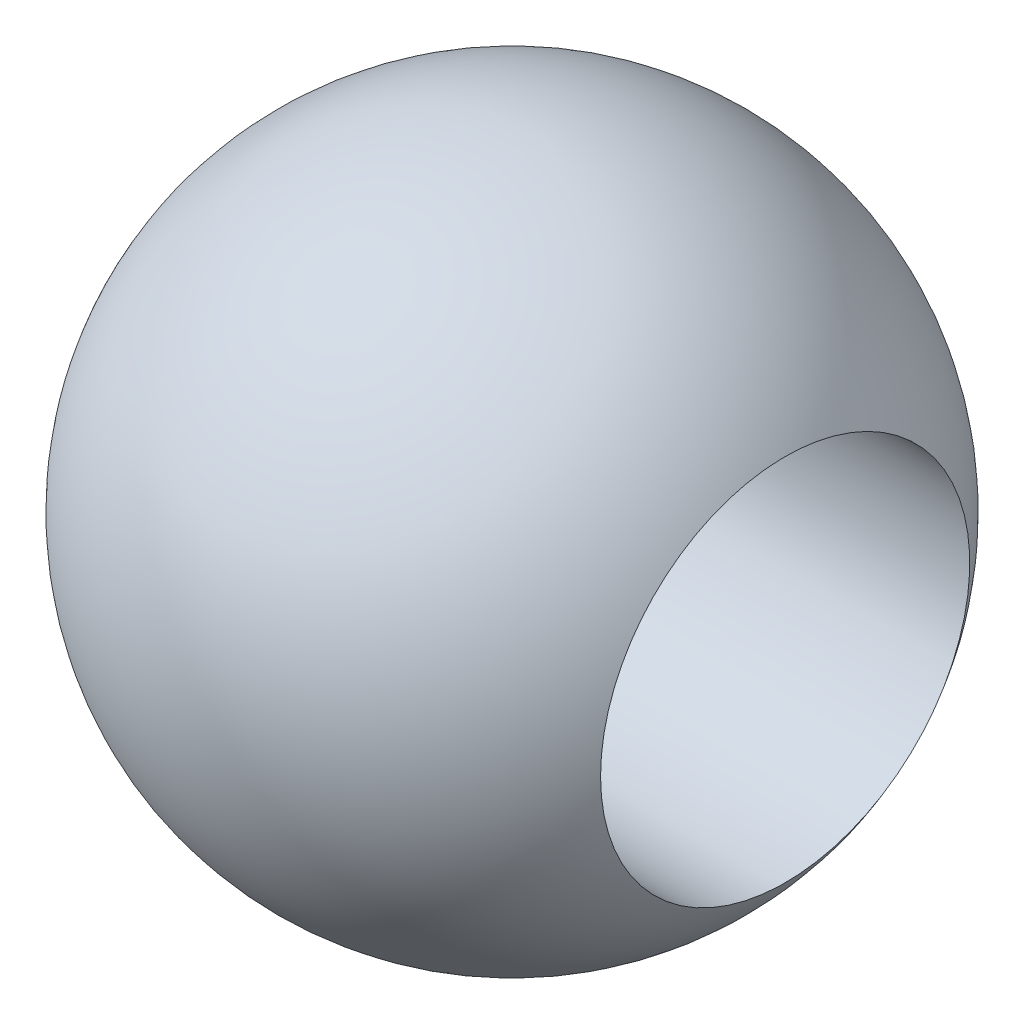
from build123d import *

# Parameters (mm, degrees)
WYTNIJ_WYCI_GNI_CIE1_DEPTH      = 22.650635095
WYTNIJ_WYCI_GNI_CIE1_DEPTH_BACK = 22.650635095
SZKIC3_R                        = 7


with BuildPart() as part:
    # Szkic2 → Obrót1 (revolve)
    with BuildSketch(Plane.XY):
        with BuildLine():
            Line((0, 12.5), (0, -12.5))
            ThreePointArc((0, -12.5), (-12.5, 0), (0, 12.5))
        make_face()
    revolve(axis=Axis((0, 63.085106383, 0), (0, -1, 0)))

    # Szkic3 → Wytnij-wyciągnięcie1 (cut, two sides: drawn at the far end of the back side and taken through both)
    with BuildSketch(Plane(origin=(0, 0, 0), x_dir=(0, 0, -1), z_dir=(1, 0, 0)).offset(-WYTNIJ_WYCI_GNI_CIE1_DEPTH_BACK)):
        with Locations(Location((0, 0, 0), (0, 0, 180))):
            Circle(SZKIC3_R)
    extrude(amount=WYTNIJ_WYCI_GNI_CIE1_DEPTH + WYTNIJ_WYCI_GNI_CIE1_DEPTH_BACK, mode=Mode.SUBTRACT)


solid = part.part
